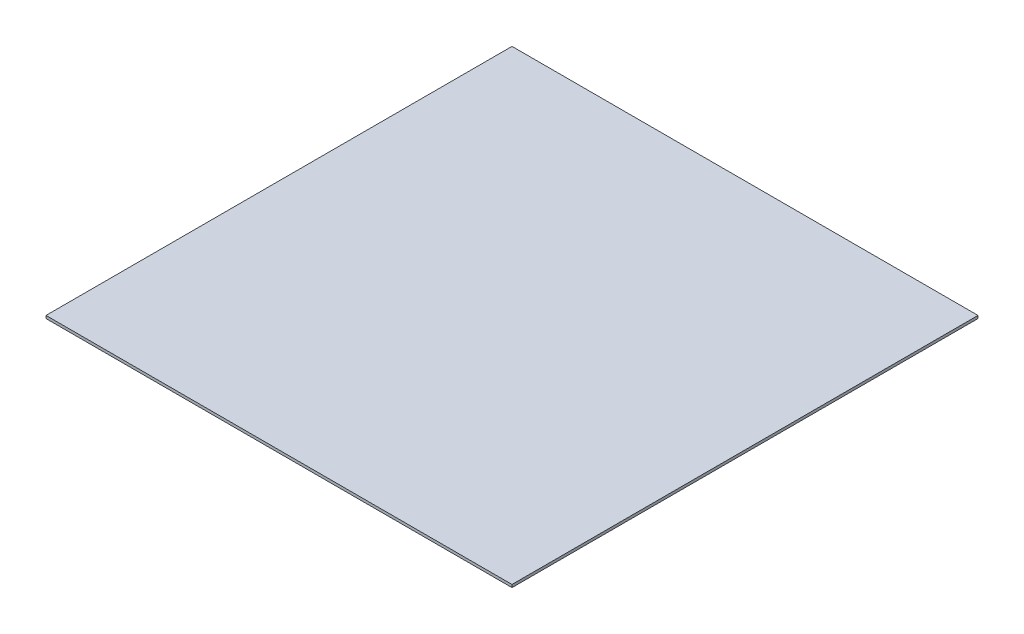
from build123d import *

# Parameters (mm, degrees)
SKETCH1_W           = 254
SKETCH1_H           = 254
BOSS_EXTRUDE1_DEPTH = 1.5


with BuildPart() as part:
    # Sketch1 → Boss-Extrude1 (new body)
    with BuildSketch(Plane(origin=(0, 0, 0), x_dir=(1, 0, 0), z_dir=(0, 1, 0))):
        with Locations((127, 127)):
            Rectangle(SKETCH1_W, SKETCH1_H)
    extrude(amount=BOSS_EXTRUDE1_DEPTH)


solid = part.part
